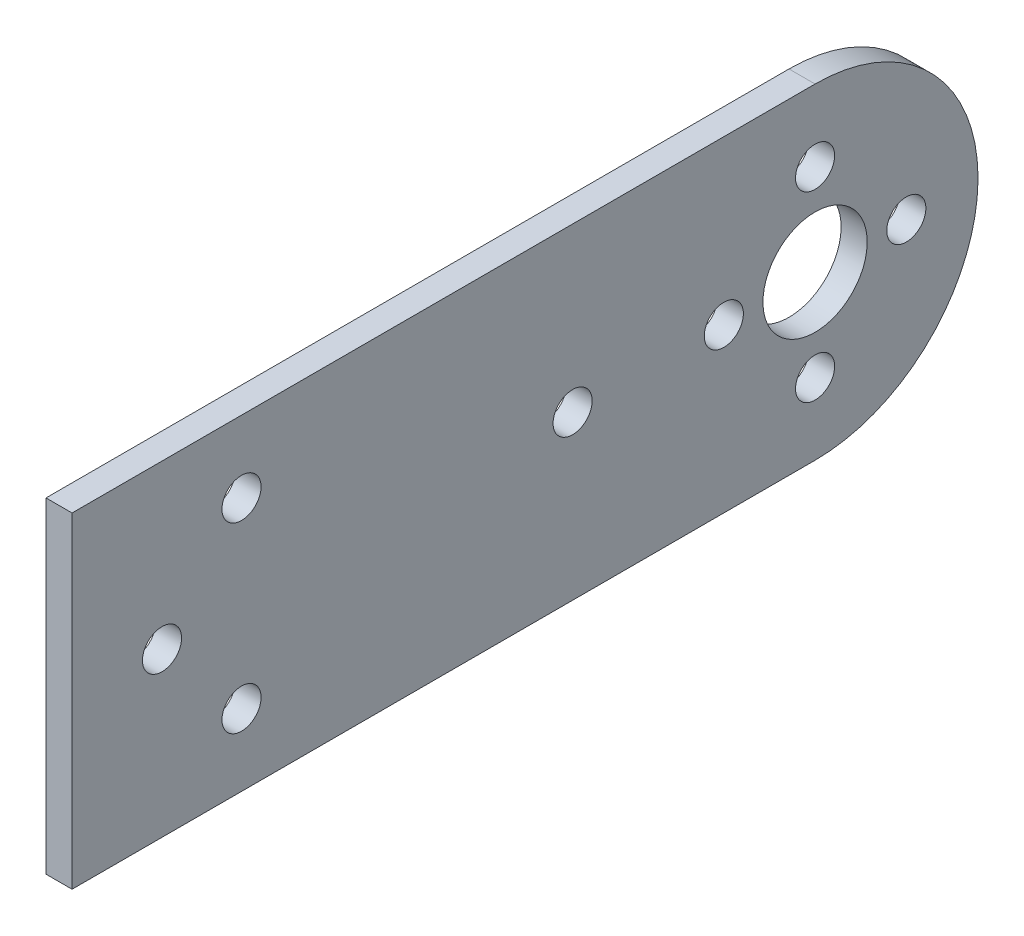
from build123d import *

# Parameters (mm, degrees)
SKETCH_1_W          = 2
SKETCH_1_H          = 25
EXTRUDE_1_DEPTH     = 69.5
SKETCH_2_R          = 1.5
SKETCH_2_R_2        = 4
CUT_EXTRUDE_2_DEPTH = 69.5
SKETCH_4_R          = 1.5
CUT_EXTRUDE_3_DEPTH = 10


with BuildPart() as part:
    # 草图1 → 凸台-拉伸1 (new body)
    with BuildSketch(Plane.XY):
        Rectangle(SKETCH_1_W, SKETCH_1_H)
    extrude(amount=EXTRUDE_1_DEPTH)

    # 草图2 → 切除-拉伸2 (cut)
    with BuildSketch(Plane(origin=(1, 0, 0), x_dir=(0, 0, -1), z_dir=(1, 0, 0))):
        with BuildLine():
            Line((0, 12.5), (-12.499054261, 12.5))
            ThreePointArc((-12.499054261, 12.5), (-3.714750597, 8.893031494), (0, 0.153761464))
            Line((0, 0.153761464), (0, 12.5))
        make_face()
        with BuildLine():
            Line((0, -12.5), (0, -0.153761464))
            ThreePointArc((0, -0.153761464), (-3.714750597, -8.893031494), (-12.499054261, -12.5))
            Line((-12.499054261, -12.5), (0, -12.5))
        make_face()
        with Locations(Location((-5.499054261, 0, 0), (0, 0, 90))):
            Circle(SKETCH_2_R)
        with Locations(Location((-12.499054261, 7, 0), (0, 0, 90))):
            Circle(SKETCH_2_R)
        with Locations(Location((-12.499054261, -7, 0), (0, 0, 90))):
            Circle(SKETCH_2_R)
        with Locations(Location((-19.499054261, 0, 0), (0, 0, 90))):
            Circle(SKETCH_2_R)
        with Locations(Location((-12.499054261, 0, 0), (0, 0, 90))):
            Circle(SKETCH_2_R_2)
        with Locations(Location((-31.099054261, 0, 0), (0, 0, 90))):
            Circle(SKETCH_2_R)
    extrude(amount=-CUT_EXTRUDE_2_DEPTH, mode=Mode.SUBTRACT)

    # 草图4 → 切除-拉伸3 (cut)
    with BuildSketch(Plane(origin=(1, 0, 0), x_dir=(0, 0, -1), z_dir=(1, 0, 0))):
        with Locations(Location((-62.6, 0, 0), (0, 0, 90))):
            Circle(SKETCH_4_R)
        with Locations(Location((-56.5, 7, 0), (0, 0, 90))):
            Circle(SKETCH_4_R)
        with Locations(Location((-56.5, -7, 0), (0, 0, 90))):
            Circle(SKETCH_4_R)
    extrude(amount=-CUT_EXTRUDE_3_DEPTH, mode=Mode.SUBTRACT)


solid = part.part
